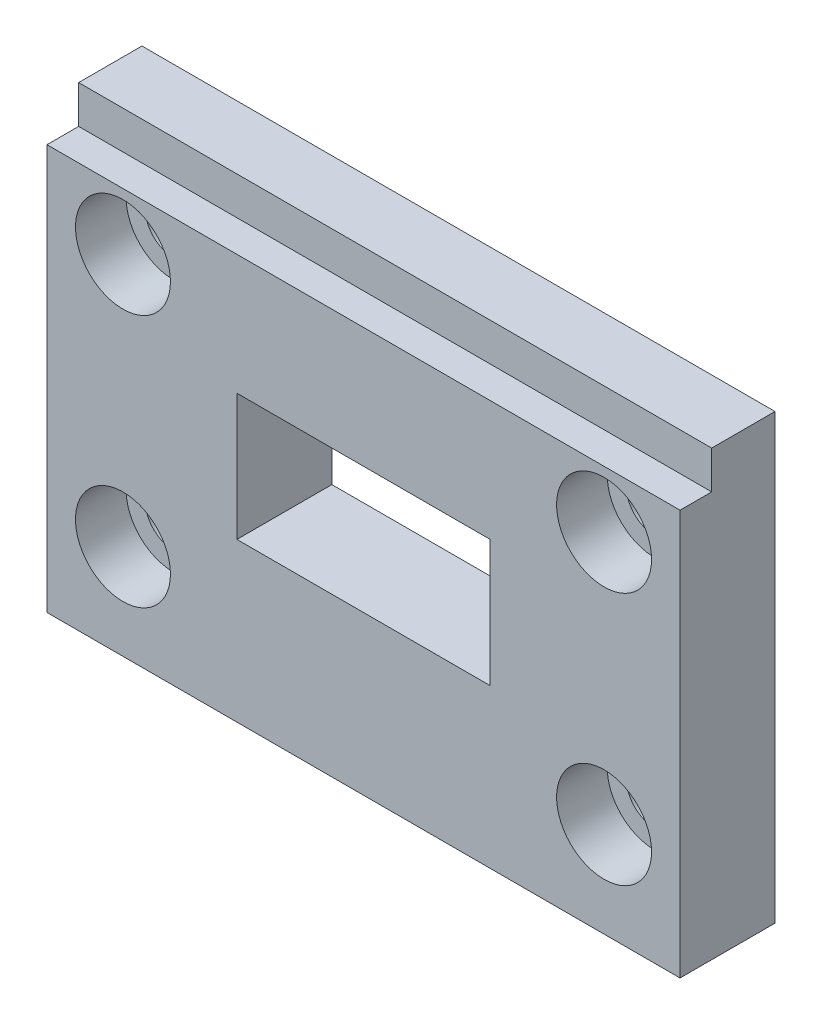
from build123d import *

# Parameters (mm, degrees)
SKETCH_1_W          = 100
SKETCH_1_H          = 70
EXTRUDE_1_DEPTH     = 15
SKETCH_2_W          = 100
SKETCH_2_H          = 6
CUT_EXTRUDE_1_DEPTH = 5
SKETCH_3_W          = 40
SKETCH_3_H          = 20
CUT_EXTRUDE_2_DEPTH = 63.84902545
SKETCH_4_R          = 7.5
CUT_EXTRUDE_3_DEPTH = 8
SKETCH_5_R          = 4.5
CUT_EXTRUDE_4_DEPTH = 63.84902545


with BuildPart() as part:
    # 草图1 → 凸台-拉伸1 (new body)
    with BuildSketch(Plane.XY):
        Rectangle(SKETCH_1_W, SKETCH_1_H)
    extrude(amount=EXTRUDE_1_DEPTH)

    # 草图2 → 切除-拉伸1 (cut)
    with BuildSketch(Plane.XY.offset(15)):
        with Locations((0, 32)):
            Rectangle(SKETCH_2_W, SKETCH_2_H)
    extrude(amount=-CUT_EXTRUDE_1_DEPTH, mode=Mode.SUBTRACT)

    # 草图3 → 切除-拉伸2 (cut, through all)
    with BuildSketch(Plane.XY):
        Rectangle(SKETCH_3_W, SKETCH_3_H)
    extrude(amount=CUT_EXTRUDE_2_DEPTH, mode=Mode.SUBTRACT)

    # 草图4 → 切除-拉伸3 (cut)
    with BuildSketch(Plane.XY.offset(15)):
        with Locations((38, 20)):
            Circle(SKETCH_4_R)
        with Locations((-38, 20)):
            Circle(SKETCH_4_R)
        with Locations((38, -20)):
            Circle(SKETCH_4_R)
        with Locations((-38, -20)):
            Circle(SKETCH_4_R)
    extrude(amount=-CUT_EXTRUDE_3_DEPTH, mode=Mode.SUBTRACT)

    # 草图5 → 切除-拉伸4 (cut, through all)
    with BuildSketch(Plane.XY.offset(15)):
        with Locations((38, 20)):
            Circle(SKETCH_5_R)
        with Locations((-38, 20)):
            Circle(SKETCH_5_R)
        with Locations((38, -20)):
            Circle(SKETCH_5_R)
        with Locations((-38, -20)):
            Circle(SKETCH_5_R)
    extrude(amount=-CUT_EXTRUDE_4_DEPTH, mode=Mode.SUBTRACT)


solid = part.part
